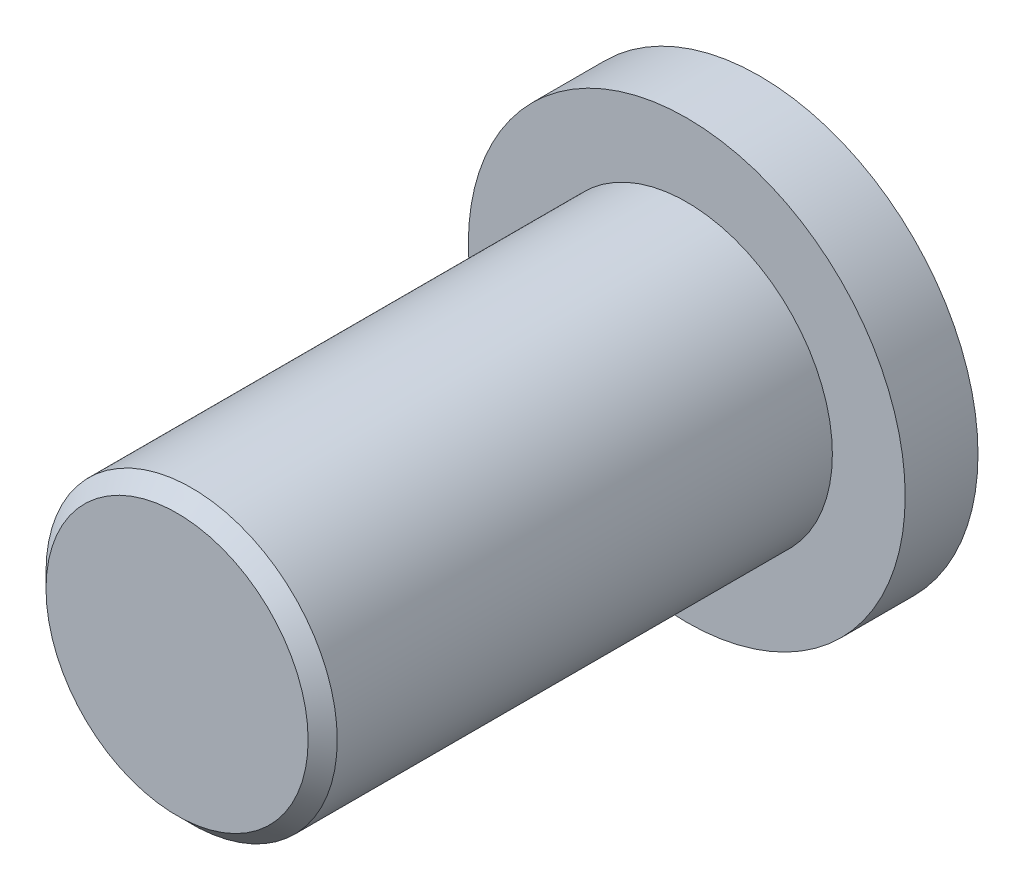
from build123d import *

# Parameters (mm, degrees)
SKETCH3_R           = 10
BOSS_EXTRUDE1_DEPTH = 35
SKETCH4_R           = 15
BOSS_EXTRUDE2_DEPTH = 5
CHAMFER1_SIZE       = 1


with BuildPart() as part:
    # Sketch3 → Boss-Extrude1 (new body)
    with BuildSketch(Plane.XY):
        Circle(SKETCH3_R)
    extrude(amount=BOSS_EXTRUDE1_DEPTH)

    # Sketch4 → Boss-Extrude2 (add)
    with BuildSketch(Plane(origin=(0, 0, 0), x_dir=(-1, 0, 0), z_dir=(0, 0, -1))):
        Circle(SKETCH4_R)
    extrude(amount=BOSS_EXTRUDE2_DEPTH)

    # Chamfer1
    chamfer1_edges = [part.edges().sort_by_distance(p)[0] for p in [
        (-10, 0, 35),
    ]]
    chamfer(chamfer1_edges, length=CHAMFER1_SIZE)


solid = part.part
